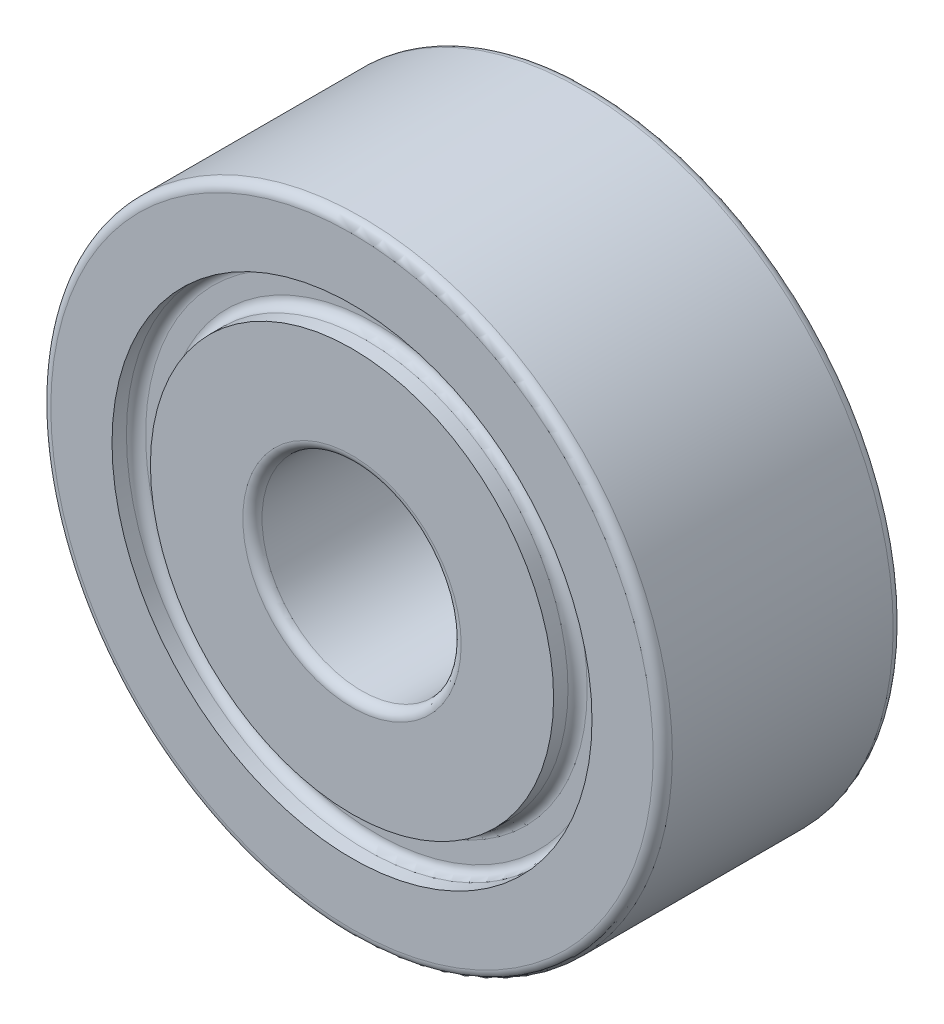
from build123d import *

# Parameters (mm, degrees)
SKETCH1_R           = 6.475
BOSS_EXTRUDE1_DEPTH = 5
SKETCH2_R           = 2.075
CUT_EXTRUDE1_DEPTH  = 11.433180244
SKETCH3_R           = 5
SKETCH3_R_2         = 4.2
CUT_EXTRUDE2_DEPTH  = 0.5
FILLET1_R           = 0.2
CUT_EXTRUDE3_START  = -0.5
SKETCH4_R           = 5
SKETCH4_R_2         = 4.2
CUT_EXTRUDE3_DEPTH  = 0.5
FILLET2_R           = 0.2
FILLET3_R           = 0.2


with BuildPart() as part:
    # Sketch1 → Boss-Extrude1 (new body)
    with BuildSketch(Plane.XY):
        Circle(SKETCH1_R)
    extrude(amount=BOSS_EXTRUDE1_DEPTH)

    # Sketch2 → Cut-Extrude1 (cut, through all)
    with BuildSketch(Plane.XY.offset(5)):
        Circle(SKETCH2_R)
    extrude(amount=-CUT_EXTRUDE1_DEPTH, mode=Mode.SUBTRACT)

    # Sketch3 → Cut-Extrude2 (cut)
    with BuildSketch(Plane.XY.offset(5)):
        Circle(SKETCH3_R)
        Circle(SKETCH3_R_2, mode=Mode.SUBTRACT)
    extrude(amount=-CUT_EXTRUDE2_DEPTH, mode=Mode.SUBTRACT)

    # Fillet1
    fillet1_edges = [part.edges().sort_by_distance(p)[0] for p in [
        (-5, 0, 4.5),
        (-4.2, 0, 4.5),
    ]]
    fillet(fillet1_edges, radius=FILLET1_R)

    # Sketch4 → Cut-Extrude3 (cut)
    with BuildSketch(Plane(origin=(0, 0, 0), x_dir=(-1, 0, 0), z_dir=(0, 0, -1)).offset(CUT_EXTRUDE3_START)):
        with Locations(Location((0, 0, 0), (0, 0, 180))):
            Circle(SKETCH4_R)
        with Locations(Location((0, 0, 0), (0, 0, 180))):
            Circle(SKETCH4_R_2, mode=Mode.SUBTRACT)
    extrude(amount=CUT_EXTRUDE3_DEPTH, mode=Mode.SUBTRACT)

    # Fillet2
    fillet2_edges = [part.edges().sort_by_distance(p)[0] for p in [
        (-5, 0, 0.5),
        (-4.2, 0, 0.5),
    ]]
    fillet(fillet2_edges, radius=FILLET2_R)

    # Fillet3
    fillet3_edges = [part.edges().sort_by_distance(p)[0] for p in [
        (-6.475, 0, 0),
        (-6.475, 0, 5),
        (-2.075, 0, 0),
        (-2.075, 0, 5),
    ]]
    fillet(fillet3_edges, radius=FILLET3_R)


solid = part.part
